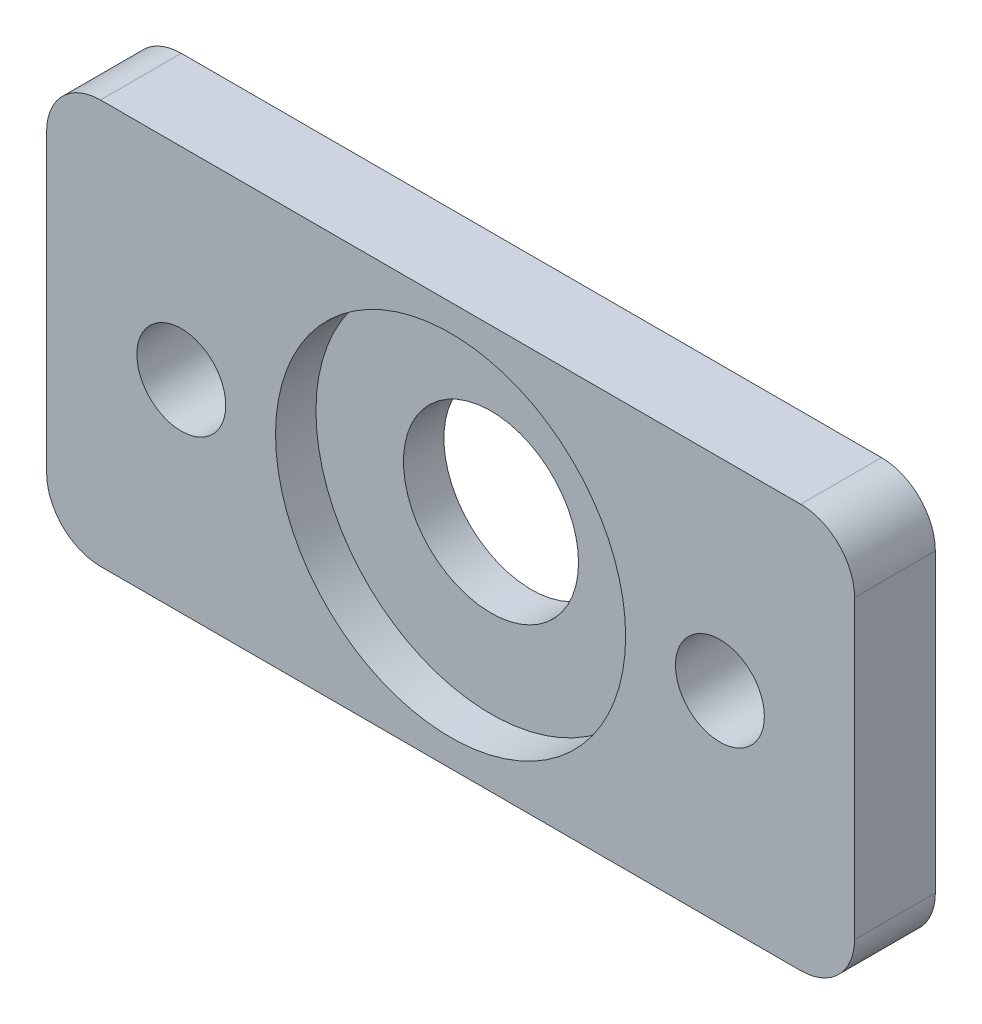
from build123d import *

# Parameters (mm, degrees)
EXTRUDE_1_DEPTH     = 3
SKETCH_2_R          = 6.5
CUT_EXTRUDE_1_DEPTH = 1.5
SKETCH_3_R          = 3.25
CUT_EXTRUDE_2_DEPTH = 34.674916481
SKETCH_4_R          = 1.65
CUT_EXTRUDE_3_DEPTH = 34.674916481


with BuildPart() as part:
    # Эскиз1 → Бобышка-Вытянуть1 (new body)
    with BuildSketch(Plane.XY):
        with BuildLine():
            Line((2, 0), (28, 0))
            ThreePointArc((28, 0), (29.414213562, 0.585786438), (30, 2))
            Line((30, 2), (30, 13))
            ThreePointArc((30, 13), (29.414213562, 14.414213562), (28, 15))
            Line((28, 15), (2, 15))
            ThreePointArc((2, 15), (0.585786438, 14.414213562), (0, 13))
            Line((0, 13), (0, 2))
            ThreePointArc((0, 2), (0.585786438, 0.585786438), (2, 0))
        make_face()
    extrude(amount=EXTRUDE_1_DEPTH)

    # Эскиз2 → Вырез-Вытянуть1 (cut)
    with BuildSketch(Plane.XY.offset(3)):
        with Locations((15, 7.5)):
            Circle(SKETCH_2_R)
    extrude(amount=-CUT_EXTRUDE_1_DEPTH, mode=Mode.SUBTRACT)

    # Эскиз3 → Вырез-Вытянуть2 (cut, through all)
    with BuildSketch(Plane.XY.offset(3)):
        with Locations((15, 7.5)):
            Circle(SKETCH_3_R)
    extrude(amount=-CUT_EXTRUDE_2_DEPTH, mode=Mode.SUBTRACT)

    # Эскиз4 → Вырез-Вытянуть3 (cut, through all)
    with BuildSketch(Plane.XY.offset(3)):
        with Locations((5, 7.5)):
            Circle(SKETCH_4_R)
        with Locations((25, 7.5)):
            Circle(SKETCH_4_R)
    extrude(amount=-CUT_EXTRUDE_3_DEPTH, mode=Mode.SUBTRACT)


solid = part.part
